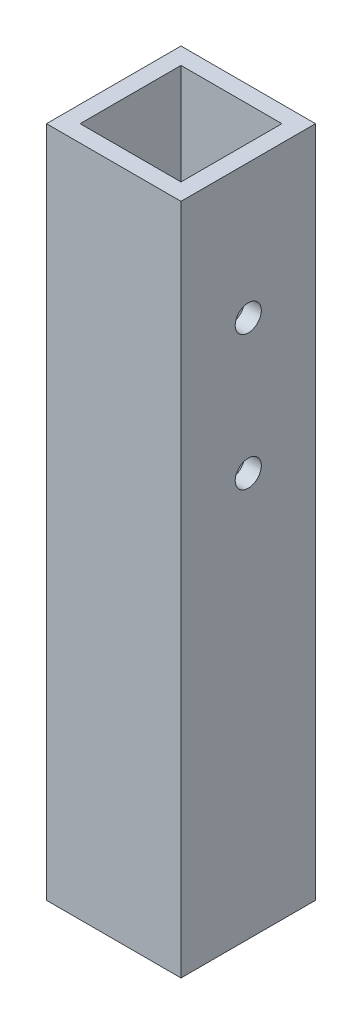
from build123d import *

# Parameters (mm, degrees)
SKETCH1_W           = 25.4
SKETCH1_H           = 25.4
SKETCH1_W_2         = 19.05
SKETCH1_H_2         = 19.05
BOSS_EXTRUDE1_DEPTH = 127
SKETCH2_R           = 2.4638
CUT_EXTRUDE1_DEPTH  = 131.136274728


with BuildPart() as part:
    # Sketch1 → Boss-Extrude1 (new body)
    with BuildSketch(Plane(origin=(0, 0, 0), x_dir=(1, 0, 0), z_dir=(0, 1, 0))):
        Rectangle(SKETCH1_W, SKETCH1_H)
        Rectangle(SKETCH1_W_2, SKETCH1_H_2, mode=Mode.SUBTRACT)
    extrude(amount=BOSS_EXTRUDE1_DEPTH)

    # Sketch2 → Cut-Extrude1 (cut, through all)
    with BuildSketch(Plane(origin=(12.7, 0, 0), x_dir=(0, 0, -1), z_dir=(1, 0, 0))):
        with Locations((0, 101.6)):
            Circle(SKETCH2_R)
        with Locations((0, 76.2)):
            Circle(SKETCH2_R)
    extrude(amount=-CUT_EXTRUDE1_DEPTH, mode=Mode.SUBTRACT)


solid = part.part
